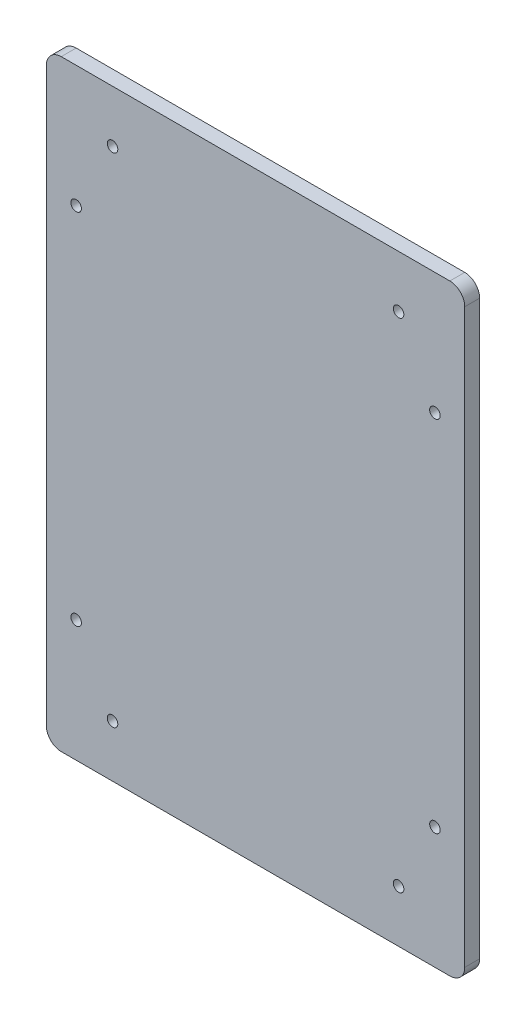
from build123d import *

# Parameters (mm, degrees)
SKETCH1_W             = 178.3207
SKETCH1_H             = 256.54
BOSS_EXTRUDE1_DEPTH   = 6.35
FILLET1_R             = 6.35
F_8_CLEARANCE_HOLE1_D = 4.4958


with BuildPart() as part:
    # Sketch1 → Boss-Extrude1 (new body)
    with BuildSketch(Plane.XY):
        Rectangle(SKETCH1_W, SKETCH1_H)
    extrude(amount=BOSS_EXTRUDE1_DEPTH)

    # Fillet1
    fillet1_edges = [part.edges().sort_by_distance(p)[0] for p in [
        (89.16035, -128.27, 3.175),
        (-89.16035, -128.27, 3.175),
        (-89.16035, 128.27, 3.175),
        (89.16035, 128.27, 3.175),
    ]]
    fillet(fillet1_edges, radius=FILLET1_R)

    # #8 Clearance Hole1 (through all)
    with Locations(Plane(origin=(0, 0, 0), x_dir=(-1, 0, 0), z_dir=(0, 0, -1))):
        with Locations((-60.96, 106.045), (60.96, 106.045), (-60.96, -106.045), (60.96, -106.045), (-76.46035, -76.46035), (-76.46035, 76.46035), (76.46035, 76.46035), (76.46035, -76.46035)):
            Hole(F_8_CLEARANCE_HOLE1_D / 2)


solid = part.part
